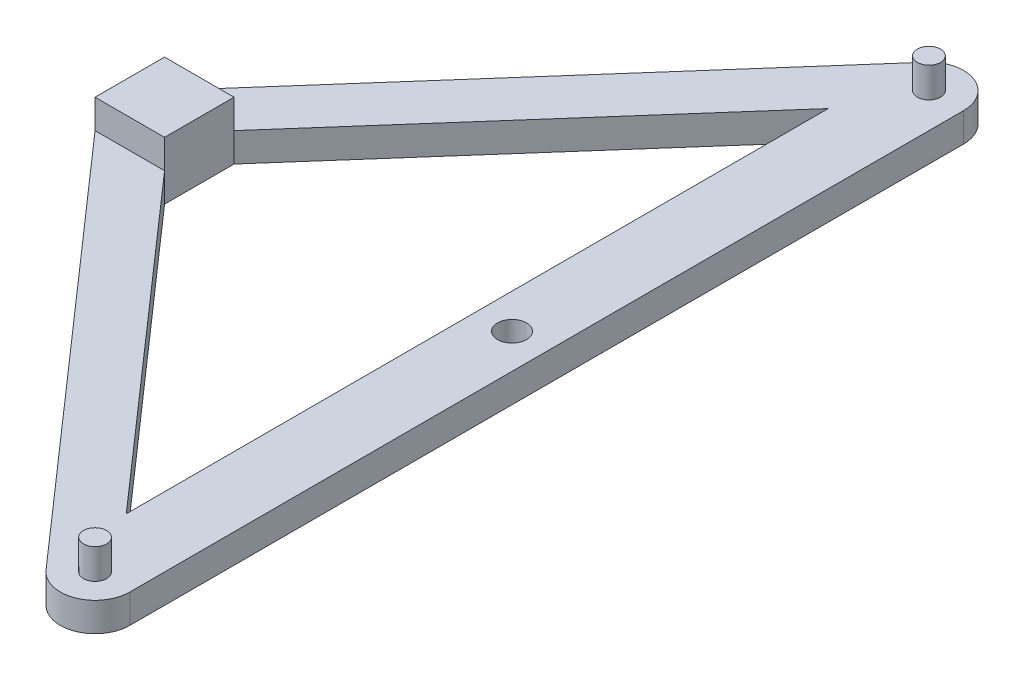
from build123d import *

# Parameters (mm, degrees)
BOSS_EXTRUDE1_DEPTH = 3.175
SKETCH3_W           = 7.62
SKETCH3_H           = 7.62
BOSS_EXTRUDE2_DEPTH = 6.35
CUT_EXTRUDE1_REACH  = 66.96
SKETCH5_R           = 1.5875
SKETCH6_R           = 1.27
BOSS_EXTRUDE3_DEPTH = 3.302
SKETCH9_R           = 1.651
CUT_EXTRUDE3_DEPTH  = 3.175


with BuildPart() as part:
    # Sketch2 → Boss-Extrude1 (new body)
    with BuildSketch(Plane(origin=(0, 0, 0), x_dir=(1, 0, 0), z_dir=(0, 1, 0))):
        with BuildLine():
            Line((3.81, 45.72), (3.81, -45.72))
            ThreePointArc((3.81, -45.72), (1.344074772, -49.285047406), (-2.861686618, -48.235322981))
            Line((-2.861686618, -48.235322981), (-41.91, -3.81))
            Line((-41.91, -3.81), (-34.29, -3.81))
            Line((-34.29, -3.81), (-3.81, -38.487140373))
            Line((-3.81, -38.487140373), (-3.81, 38.487140373))
            Line((-3.81, 38.487140373), (-34.29, 3.81))
            Line((-34.29, 3.81), (-41.91, 3.81))
            Line((-41.91, 3.81), (-2.861686618, 48.235322981))
            ThreePointArc((-2.861686618, 48.235322981), (1.344074772, 49.285047406), (3.81, 45.72))
        make_face()
    extrude(amount=BOSS_EXTRUDE1_DEPTH)

    # Sketch3 → Boss-Extrude2 (add)
    with BuildSketch(Plane(origin=(0, 0, 0), x_dir=(1, 0, 0), z_dir=(0, 1, 0))):
        with Locations((-38.1, 0)):
            Rectangle(SKETCH3_W, SKETCH3_H)
    extrude(amount=BOSS_EXTRUDE2_DEPTH)

    # Sketch5 → Cut-Extrude1 (cut, up to next)
    with BuildSketch(Plane(origin=(0, 3.175, 0), x_dir=(1, 0, 0), z_dir=(0, 1, 0)), mode=Mode.PRIVATE) as cut_extrude1_sk1:
        with Locations(Location((0, 0, 0), (0, 0, 270))):
            Circle(SKETCH5_R)
    cut_extrude1_tool1 = extrude(cut_extrude1_sk1.sketch, amount=-CUT_EXTRUDE1_REACH, mode=Mode.PRIVATE) & part.part
    add(cut_extrude1_tool1.solids().sort_by_distance((0, 3.175, 0))[0], mode=Mode.SUBTRACT)

    # Sketch6 → Boss-Extrude3 (add)
    with BuildSketch(Plane(origin=(0, 3.175, 0), x_dir=(1, 0, 0), z_dir=(0, 1, 0))):
        with Locations(Location((0, 45.72, 0), (0, 0, 90))):
            Circle(SKETCH6_R)
        with Locations(Location((0, -45.72, 0), (0, 0, 90))):
            Circle(SKETCH6_R)
    extrude(amount=BOSS_EXTRUDE3_DEPTH)

    # Sketch9 → Cut-Extrude3 (cut)
    with BuildSketch(Plane.ZY.offset(41.91)):
        with Locations((0, 3.175)):
            Circle(SKETCH9_R)
    extrude(amount=-CUT_EXTRUDE3_DEPTH, mode=Mode.SUBTRACT)


solid = part.part
